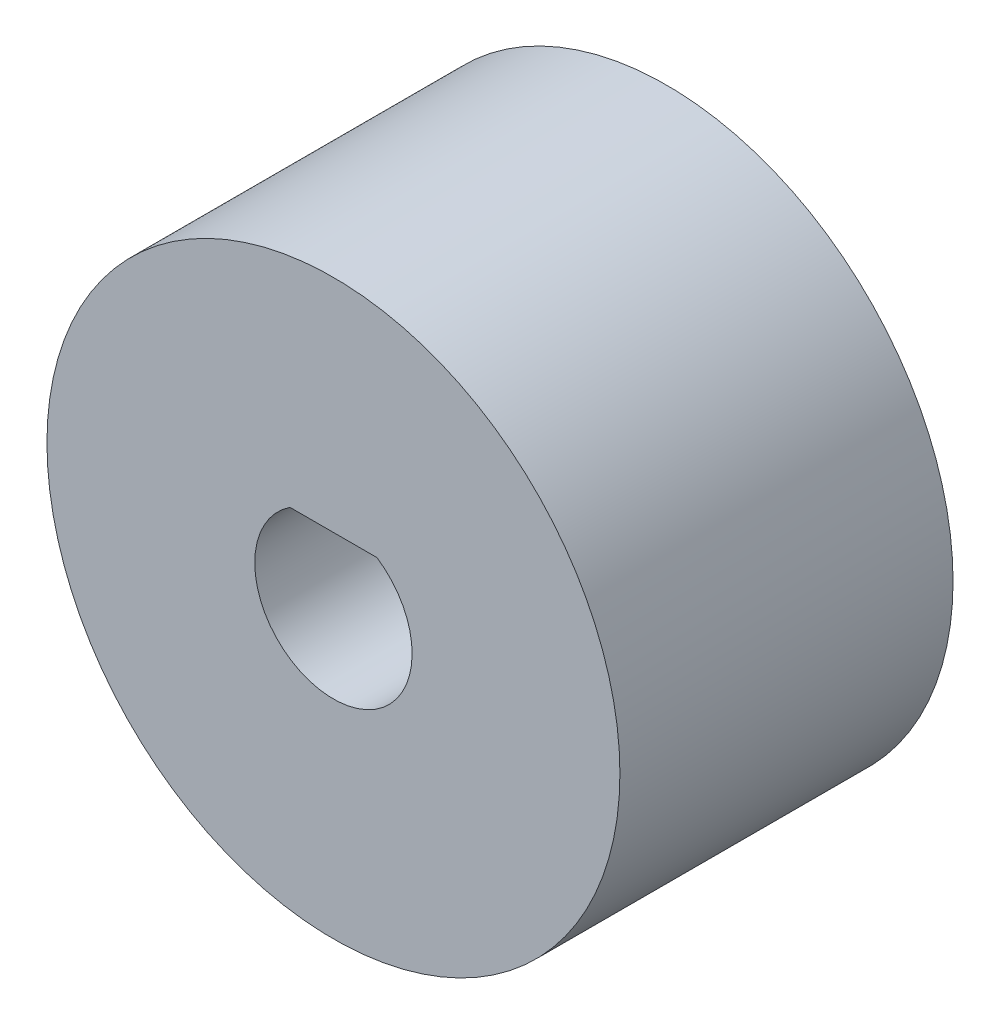
from build123d import *

# Parameters (mm, degrees)
SKETCH1_R           = 10.922
BOSS_EXTRUDE1_DEPTH = 12.7


with BuildPart() as part:
    # Sketch1 → Boss-Extrude1 (new body)
    with BuildSketch(Plane.XY):
        Circle(SKETCH1_R)
        with BuildLine():
            Line((-1.658312395, 2.5), (1.658312395, 2.5))
            ThreePointArc((1.658312395, 2.5), (0, -3), (-1.658312395, 2.5))
        make_face(mode=Mode.SUBTRACT)
    extrude(amount=BOSS_EXTRUDE1_DEPTH)


solid = part.part
